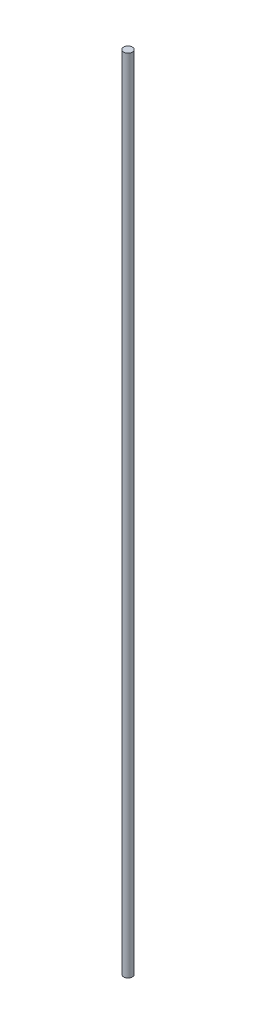
from build123d import *

# Parameters (mm, degrees)
SKETCH2_R           = 4
BOSS_EXTRUDE1_DEPTH = 730


with BuildPart() as part:
    # Sketch2 → Boss-Extrude1 (new body)
    with BuildSketch(Plane(origin=(0, 0, 0), x_dir=(1, 0, 0), z_dir=(0, 1, 0))):
        with Locations(Location((0, 0, 0), (0, 0, 90))):
            Circle(SKETCH2_R)
    extrude(amount=BOSS_EXTRUDE1_DEPTH)


solid = part.part
